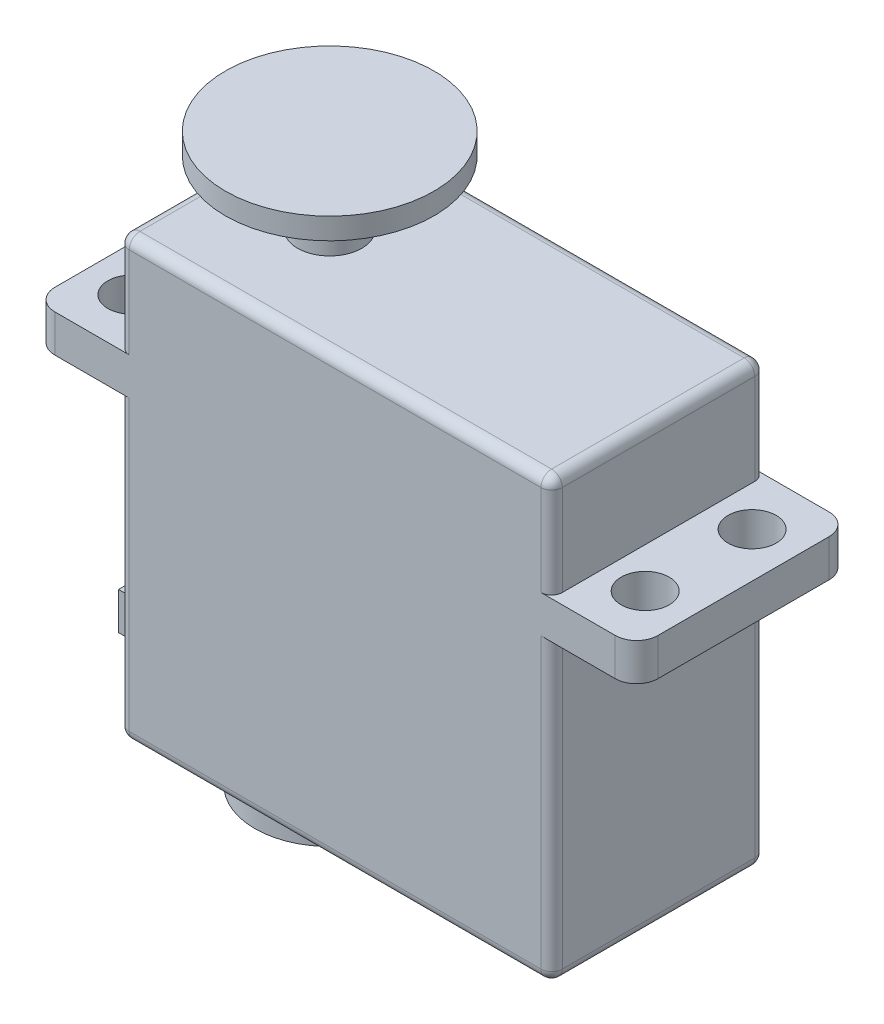
from build123d import *

# Parameters (mm, degrees)
SKETCH1_W           = 40.5
SKETCH1_H           = 20
BOSS_EXTRUDE1_DEPTH = 41
SKETCH2_W           = 56.4
SKETCH2_H           = 20
SKETCH2_R           = 2.25
BOSS_EXTRUDE2_DEPTH = 3.5
SKETCH3_R           = 3
BOSS_EXTRUDE3_DEPTH = 6
SKETCH4_W           = 10
SKETCH4_H           = 3.5
BOSS_EXTRUDE4_DEPTH = 5
FILLET1_R           = 2
FILLET2_R           = 1
FILLET3_R           = 1
SKETCH5_R           = 9.75
BOSS_EXTRUDE5_DEPTH = 2
SKETCH6_R           = 7
SKETCH6_R_2         = 4
BOSS_EXTRUDE6_DEPTH = 4


with BuildPart() as part:
    # Sketch1 → Boss-Extrude1 (new body)
    with BuildSketch(Plane(origin=(0, 0, 0), x_dir=(1, 0, 0), z_dir=(0, 1, 0))):
        Rectangle(SKETCH1_W, SKETCH1_H)
    extrude(amount=BOSS_EXTRUDE1_DEPTH)

    # Sketch2 → Boss-Extrude2 (add)
    with BuildSketch(Plane(origin=(0, 28, 0), x_dir=(-1, 0, 0), z_dir=(0, -1, 0))):
        Rectangle(SKETCH2_W, SKETCH2_H)
        with Locations(Location((-24, 5, 0), (0, 0, 90))):
            Circle(SKETCH2_R, mode=Mode.SUBTRACT)
        with Locations(Location((24, 5, 0), (0, 0, 90))):
            Circle(SKETCH2_R, mode=Mode.SUBTRACT)
        with Locations(Location((24, -5, 0), (0, 0, 90))):
            Circle(SKETCH2_R, mode=Mode.SUBTRACT)
        with Locations(Location((-24, -5, 0), (0, 0, 90))):
            Circle(SKETCH2_R, mode=Mode.SUBTRACT)
    extrude(amount=-BOSS_EXTRUDE2_DEPTH)

    # Sketch3 → Boss-Extrude3 (add)
    with BuildSketch(Plane(origin=(0, 41, 0), x_dir=(1, 0, 0), z_dir=(0, 1, 0))):
        with Locations(Location((-10.5, 0, 0), (0, 0, 270))):
            Circle(SKETCH3_R)
    extrude(amount=BOSS_EXTRUDE3_DEPTH)

    # Sketch4 → Boss-Extrude4 (add)
    with BuildSketch(Plane.ZY.offset(20.25)):
        with Locations((0, 5.25)):
            Rectangle(SKETCH4_W, SKETCH4_H)
    extrude(amount=BOSS_EXTRUDE4_DEPTH)

    # Fillet1
    fillet1_edges = [part.edges().sort_by_distance(p)[0] for p in [
        (28.2, 29.75, -10),
        (-28.2, 29.75, 10),
        (28.2, 29.75, 10),
        (-28.2, 29.75, -10),
    ]]
    fillet(fillet1_edges, radius=FILLET1_R)

    # Fillet2
    fillet2_edges = [part.edges().sort_by_distance(p)[0] for p in [
        (20.25, 14, 10),
        (-20.25, 14, 10),
        (-20.25, 14, -10),
        (20.25, 14, -10),
        (0, 0, 10),
        (-20.25, 0, 0),
        (0, 0, -10),
        (20.25, 0, 0),
        (-20.25, 36.25, 10),
        (-20.25, 36.25, -10),
    ]]
    fillet(fillet2_edges, radius=FILLET2_R)

    # Fillet3
    fillet3_edges = [part.edges().sort_by_distance(p)[0] for p in [
        (0.5, 41, 10),
        (-20.25, 41, 0),
        (-19.957106781, 41, 9.707106781),
        (-19.957106781, 41, -9.707106781),
        (20.25, 41, 0),
        (20.25, 36.25, 10),
        (20.25, 36.25, -10),
        (0.5, 41, -10),
    ]]
    fillet(fillet3_edges, radius=FILLET3_R)

    # Sketch5 → Boss-Extrude5 (add)
    with BuildSketch(Plane(origin=(0, 47, 0), x_dir=(1, 0, 0), z_dir=(0, 1, 0))):
        with Locations(Location((-10.5, 0, 0), (0, 0, 270))):
            Circle(SKETCH5_R)
    extrude(amount=BOSS_EXTRUDE5_DEPTH)

    # Sketch6 → Boss-Extrude6 (add)
    with BuildSketch(Plane.XZ):
        with Locations(Location((-10.5, 0, 0), (0, 0, 90))):
            Circle(SKETCH6_R)
        with Locations(Location((-10.5, 0, 0), (0, 0, 270))):
            Circle(SKETCH6_R_2, mode=Mode.SUBTRACT)
    extrude(amount=BOSS_EXTRUDE6_DEPTH)


solid = part.part
